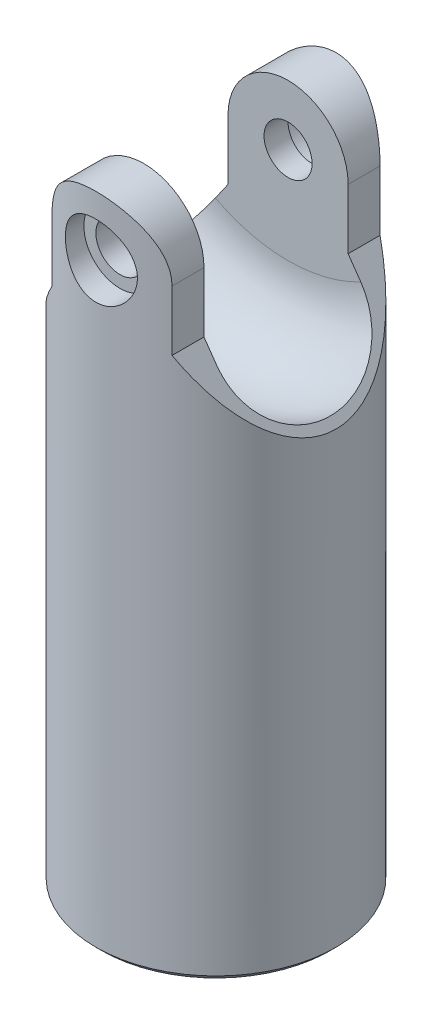
from build123d import *

# Parameters (mm, degrees)
CROQUIS1_R                 = 20
SALIENTE_EXTRUIR1_DEPTH    = 110
CORTAR_EXTRUIR1_DEPTH      = 110
CORTAR_EXTRUIR1_DEPTH_BACK = 110
CORTAR_EXTRUIR2_DEPTH      = 110
CORTAR_EXTRUIR2_DEPTH_BACK = 110
CROQUIS4_R                 = 4
CROQUIS5_R                 = 6
CORTAR_EXTRUIR4_DEPTH      = 4
CORTAR_EXTRUIR5_DEPTH      = 44
CHAFL_N1_SIZE              = 1


with BuildPart() as part:
    # Croquis1 → Saliente-Extruir1 (new body)
    with BuildSketch(Plane(origin=(0, 0, 0), x_dir=(1, 0, 0), z_dir=(0, 1, 0))):
        Circle(CROQUIS1_R)
    extrude(amount=SALIENTE_EXTRUIR1_DEPTH)

    # Croquis2 → Cortar-Extruir1 (cut, two sides: drawn at the far end of the back side and taken through both)
    with BuildSketch(Plane.XY.offset(-CORTAR_EXTRUIR1_DEPTH_BACK)):
        with BuildLine():
            Line((20, 110), (0, 110))
            ThreePointArc((0, 110), (7.071067812, 107.071067812), (10, 100))
            Line((10, 100), (10, 90))
            Line((10, 90), (20, 75.718519933))
            Line((20, 75.718519933), (20, 110))
        make_face()
        with BuildLine():
            Line((-10, 90), (-10, 100))
            ThreePointArc((-10, 100), (-7.071067812, 107.071067812), (0, 110))
            Line((0, 110), (-20, 110))
            Line((-20, 110), (-20, 75.718519933))
            Line((-20, 75.718519933), (-10, 90))
        make_face()
    extrude(amount=CORTAR_EXTRUIR1_DEPTH + CORTAR_EXTRUIR1_DEPTH_BACK, mode=Mode.SUBTRACT)

    # Croquis4 → Cortar-Extruir2 (cut, two sides: drawn at the far end of the back side and taken through both)
    with BuildSketch(Plane.XY.offset(-CORTAR_EXTRUIR2_DEPTH_BACK)):
        with Locations((0, 100)):
            Circle(CROQUIS4_R)
    extrude(amount=CORTAR_EXTRUIR2_DEPTH + CORTAR_EXTRUIR2_DEPTH_BACK, mode=Mode.SUBTRACT)

    # Croquis3 → Cortar-Revolución1 (revolve, cut)
    with BuildSketch(Plane(origin=(0, 0, 0), x_dir=(0, 0, -1), z_dir=(1, 0, 0))):
        with BuildLine():
            Line((-12, 110), (12, 110))
            Line((12, 110), (12, 84))
            ThreePointArc((12, 84), (0, 72), (-12, 84))
            Line((-12, 84), (-12, 110))
        make_face()
    revolve(axis=Axis((0, 110, 12), (0, 0, -1)), mode=Mode.SUBTRACT)

    # Croquis5 → Cortar-Extruir4 (cut)
    with BuildSketch(Plane.XY.offset(20)):
        with Locations((0, 100)):
            Circle(CROQUIS5_R)
    cortar_extruir4 = extrude(amount=-CORTAR_EXTRUIR4_DEPTH, mode=Mode.SUBTRACT)

    # Simetría1: Cortar-Extruir4 across plane
    add(cortar_extruir4.mirror(Plane.XY), mode=Mode.SUBTRACT)

    # Croquis6 → Cortar-Revolución2 (revolve, cut)
    with BuildSketch(Plane.XY):
        Polygon((-9, 0), (0, 0), (0, 70), (-14, 70), (-14, 30), (-9, 30), align=None)
    revolve(axis=Axis((0, 70, 0), (0, -1, 0)), mode=Mode.SUBTRACT)

    # Croquis7 → Cortar-Extruir5 (cut)
    with BuildSketch(Plane.XZ):
        with BuildLine():
            Line((-9.239334584, 3.827057692), (-8.314915793, 3.444150891))
            ThreePointArc((-8.314915793, 3.444150891), (-9, 0), (-8.314915793, -3.444150891))
            Line((-8.314915793, -3.444150891), (-9.239334584, -3.827057692))
            ThreePointArc((-9.239334584, -3.827057692), (-7.071480543, -7.071480543), (-3.827057692, -9.239334584))
            Line((-3.827057692, -9.239334584), (-3.444150891, -8.314915793))
            ThreePointArc((-3.444150891, -8.314915793), (0, -9), (3.444150891, -8.314915793))
            Line((3.444150891, -8.314915793), (3.827057692, -9.239334584))
            ThreePointArc((3.827057692, -9.239334584), (7.071480543, -7.071480543), (9.239334584, -3.827057692))
            Line((9.239334584, -3.827057692), (8.314915793, -3.444150891))
            ThreePointArc((8.314915793, -3.444150891), (9, 0), (8.314915793, 3.444150891))
            Line((8.314915793, 3.444150891), (9.239334584, 3.827057692))
            ThreePointArc((9.239334584, 3.827057692), (7.071480543, 7.071480543), (3.827057692, 9.239334584))
            Line((3.827057692, 9.239334584), (3.444150891, 8.314915793))
            ThreePointArc((3.444150891, 8.314915793), (0, 9), (-3.444150891, 8.314915793))
            Line((-3.444150891, 8.314915793), (-3.827057692, 9.239334584))
            ThreePointArc((-3.827057692, 9.239334584), (-7.071480543, 7.071480543), (-9.239334584, 3.827057692))
        make_face()
    extrude(amount=-CORTAR_EXTRUIR5_DEPTH, mode=Mode.SUBTRACT)

    # Chaflán1
    chafl_n1_edges = [part.edges().sort_by_distance(p)[0] for p in [
        (-20, 0, 0),
    ]]
    chamfer(chafl_n1_edges, length=CHAFL_N1_SIZE)


solid = part.part
